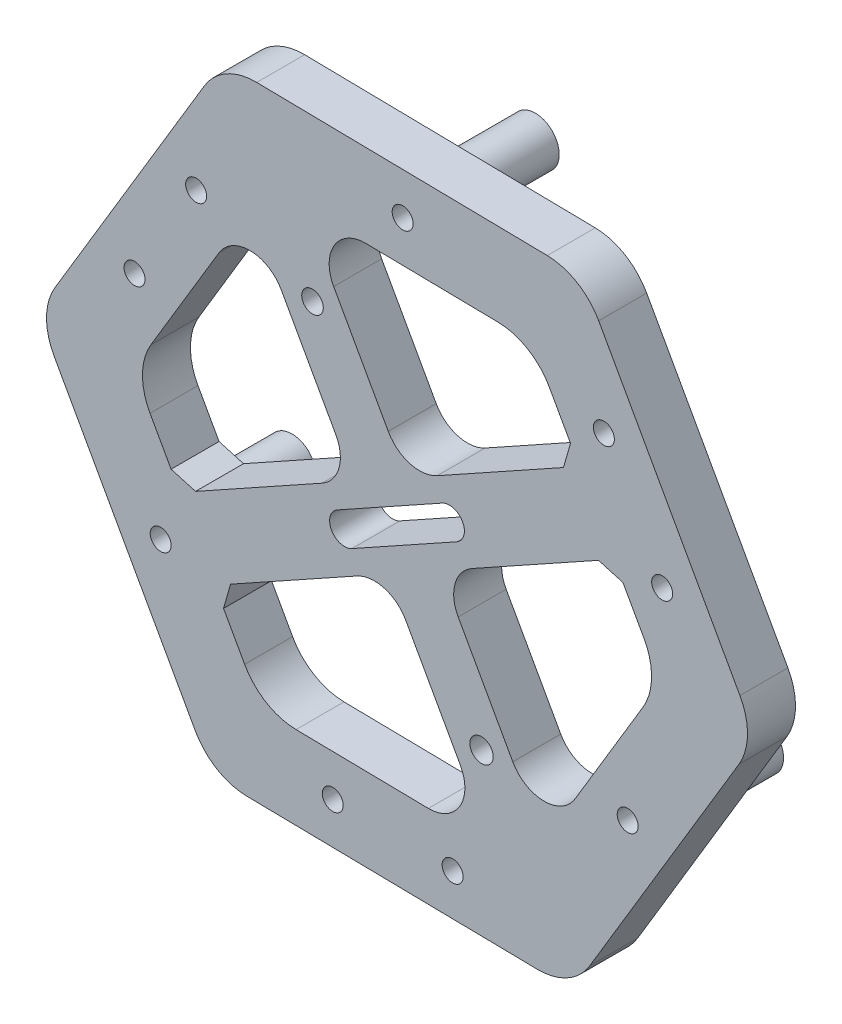
from build123d import *

# Parameters (mm, degrees)
BOSS_EXTRUDE1_DEPTH = 8
CUT_EXTRUDE1_DEPTH  = 10
SKETCH3_R           = 1.75
CUT_EXTRUDE2_DEPTH  = 10
FILLET1_R           = 10
BOSS_EXTRUDE2_DEPTH = 8
CHAMFER1_SIZE       = 3
SKETCH5_R           = 3.1
CUT_EXTRUDE3_DEPTH  = 4
BOSS_EXTRUDE3_DEPTH = 8
SKETCH9_R           = 4
BOSS_EXTRUDE5_DEPTH = 14
SKETCH10_R          = 1.75
CUT_EXTRUDE4_DEPTH  = 37
FILLET4_R           = 1
CUT_EXTRUDE5_DEPTH  = 10
FILLET9_R           = 6
FILLET10_R          = 6
SKETCH13_R          = 1.948575194
SKETCH13_R_2        = 1.8
CUT_EXTRUDE7_DEPTH  = 22


with BuildPart() as part:
    # Sketch1 → Boss-Extrude1 (new body)
    with BuildSketch(Plane.XY):
        Polygon((30.83321951, 51.480464718), (-29.16678049, 52.442583736), (-60, 0.962119017), (-30.83321951, -51.480464718), (29.16678049, -52.442583736), (60, -0.962119017), align=None)
    extrude(amount=BOSS_EXTRUDE1_DEPTH)

    # Sketch2 → Cut-Extrude1 (cut)
    with BuildSketch(Plane.XY.offset(8)):
        Polygon((-21.388972359, 38.45789474), (-44, 0.705553946), (-22.611027641, -37.752340793), (21.388972359, -38.45789474), (44, -0.705553946), (22.611027641, 37.752340793), align=None)
    extrude(amount=-CUT_EXTRUDE1_DEPTH, mode=Mode.SUBTRACT)

    # Sketch3 → Cut-Extrude2 (cut)
    with BuildSketch(Plane(origin=(0, 0, 0), x_dir=(-1, 0, 0), z_dir=(0, 0, -1))):
        with Locations((-9.276605543, -45.192747573)):
            Circle(SKETCH3_R)
        with Locations(Location((10.720823639, -44.872082458, 0), (0, 0, 180))):
            Circle(SKETCH3_R)
        with Locations((-34.499764694, 30.630149848)):
            Circle(SKETCH3_R)
        with Locations(Location((-44.220775149, 13.151535608, 0), (0, 0, 180))):
            Circle(SKETCH3_R)
        with Locations((43.776370237, 14.562597726)):
            Circle(SKETCH3_R)
        with Locations(Location((33.49995151, 31.72054685, 0), (0, 0, 180))):
            Circle(SKETCH3_R)
    extrude(amount=-CUT_EXTRUDE2_DEPTH, mode=Mode.SUBTRACT)

    # Fillet1
    fillet1_edges = [part.edges().sort_by_distance(p)[0] for p in [
        (60, -0.962119017, 4),
        (29.16678049, -52.442583736, 4),
        (-30.83321951, -51.480464718, 4),
        (-60, 0.962119017, 4),
        (-29.16678049, 52.442583736, 4),
        (30.83321951, 51.480464718, 4),
        (-21.388972359, 38.45789474, 4),
        (22.611027641, 37.752340793, 4),
        (44, -0.705553946, 4),
        (21.388972359, -38.45789474, 4),
        (-22.611027641, -37.752340793, 4),
        (-44, 0.705553946, 4),
    ]]
    fillet(fillet1_edges, radius=FILLET1_R)

    # Sketch4 → Boss-Extrude2 (add)
    with BuildSketch(Plane(origin=(0, 0, 0), x_dir=(-1, 0, 0), z_dir=(0, 0, -1))):
        Polygon((-30.389210684, 23.766977696), (36.221816957, -13.279809152), (30.389210684, -23.766977696), (-36.221816957, 13.279809152), align=None)
    extrude(amount=-BOSS_EXTRUDE2_DEPTH)

    # Chamfer1
    chamfer1_edges = [part.edges().sort_by_distance(p)[0] for p in [
        (-30.389210684, -23.766977696, 4),
        (-36.221816957, -13.279809152, 4),
        (30.389210684, 23.766977696, 4),
        (36.221816957, 13.279809152, 4),
    ]]
    chamfer(chamfer1_edges, length=CHAMFER1_SIZE)

    # Sketch5 → Cut-Extrude3 (cut)
    with BuildSketch(Plane(origin=(0, 0, 0), x_dir=(-1, 0, 0), z_dir=(0, 0, -1))):
        with Locations((43.776370237, 14.562597726)):
            Circle(SKETCH5_R)
        with Locations((33.49995151, 31.72054685)):
            Circle(SKETCH5_R)
        with Locations((-9.276605543, -45.192747573)):
            Circle(SKETCH5_R)
        with Locations((10.720823639, -44.872082458)):
            Circle(SKETCH5_R)
        with Locations((-34.499764694, 30.630149848)):
            Circle(SKETCH5_R)
        with Locations((-44.220775149, 13.151535608)):
            Circle(SKETCH5_R)
    extrude(amount=-CUT_EXTRUDE3_DEPTH, mode=Mode.SUBTRACT)

    # Sketch7 → Boss-Extrude3 (add)
    with BuildSketch(Plane(origin=(0, 0, 0), x_dir=(-1, 0, 0), z_dir=(0, 0, -1))):
        Polygon((-1.453350423, 7.673836886), (20.4189231, 47.000718924), (29.15823022, 42.140213697), (7.285956696, 2.813331658), align=None)
        Polygon((1.453350423, -7.673836886), (-20.4189231, -47.000718924), (-29.15823022, -42.140213697), (-7.285956696, -2.813331658), align=None)
    extrude(amount=-BOSS_EXTRUDE3_DEPTH)

    # Sketch9 → Boss-Extrude5 (add)
    with BuildSketch(Plane(origin=(0, 0, 0), x_dir=(-1, 0, 0), z_dir=(0, 0, -1))):
        with Locations(Location((39.520199599, -21.478309331, 0), (0, 0, 180))):
            Circle(SKETCH9_R)
        with Locations(Location((-38.471532181, -23.301561321, 0), (0, 0, 180))):
            Circle(SKETCH9_R)
        with Locations(Location((-1.054648832, 45.15288568, 0), (0, 0, 180))):
            Circle(SKETCH9_R)
    extrude(amount=BOSS_EXTRUDE5_DEPTH)

    # Sketch10 → Cut-Extrude4 (cut)
    with BuildSketch(Plane(origin=(0, 0, -14), x_dir=(-1, 0, 0), z_dir=(0, 0, -1))):
        with Locations((-38.471532181, -23.301561321)):
            Circle(SKETCH10_R)
        with Locations((-0.943977962, 44.968104852)):
            Circle(SKETCH10_R)
        with Locations((39.415510143, -21.66654353)):
            Circle(SKETCH10_R)
    extrude(amount=-CUT_EXTRUDE4_DEPTH, mode=Mode.SUBTRACT)

    # Fillet4
    fillet4_edges = [part.edges().sort_by_distance(p)[0] for p in [
        (-43.520199599, -21.478309331, 0),
        (34.471532181, -23.301561321, 0),
        (-2.945351168, 45.15288568, 0),
    ]]
    fillet(fillet4_edges, radius=FILLET4_R)

    # Sketch11 → Cut-Extrude5 (cut)
    with BuildSketch(Plane(origin=(0, 0, 0), x_dir=(-1, 0, 0), z_dir=(0, 0, -1))):
        with BuildLine():
            Line((-7.524180813, 7.045332007), (9.954433427, -2.675678448))
            ThreePointArc((9.954433427, -2.675678448), (10.9241339, -6.075631534), (7.524180813, -7.045332007))
            Line((7.524180813, -7.045332007), (-9.954433427, 2.675678448))
            ThreePointArc((-9.954433427, 2.675678448), (-10.9241339, 6.075631534), (-7.524180813, 7.045332007))
        make_face()
    extrude(amount=-CUT_EXTRUDE5_DEPTH, mode=Mode.SUBTRACT)

    # Fillet9
    fillet9_edges = [part.edges().sort_by_distance(p)[0] for p in [
        (24.355518918, -33.504821467, 4),
        (15.616211798, -38.365326694, 4),
        (-24.355518918, 33.504821467, 4),
        (-15.616211798, 38.365326694, 4),
    ]]
    fillet(fillet9_edges, radius=FILLET9_R)

    # Fillet10
    fillet10_edges = [part.edges().sort_by_distance(p)[0] for p in [
        (1.453350423, 7.673836886, 4),
        (-7.285956696, 2.813331658, 4),
        (-1.453350423, -7.673836886, 4),
        (7.285956696, -2.813331658, 4),
    ]]
    fillet(fillet10_edges, radius=FILLET10_R)

    # Sketch13 → Cut-Extrude7 (cut)
    with BuildSketch(Plane(origin=(0, 0, 0), x_dir=(-1, 0, 0), z_dir=(0, 0, -1))):
        with Locations((-14.094687316, -25.342592065)):
            Circle(SKETCH13_R)
        with Locations((14.096243004, 25.34538923)):
            Circle(SKETCH13_R_2)
    extrude(amount=-CUT_EXTRUDE7_DEPTH, mode=Mode.SUBTRACT)


solid = part.part
